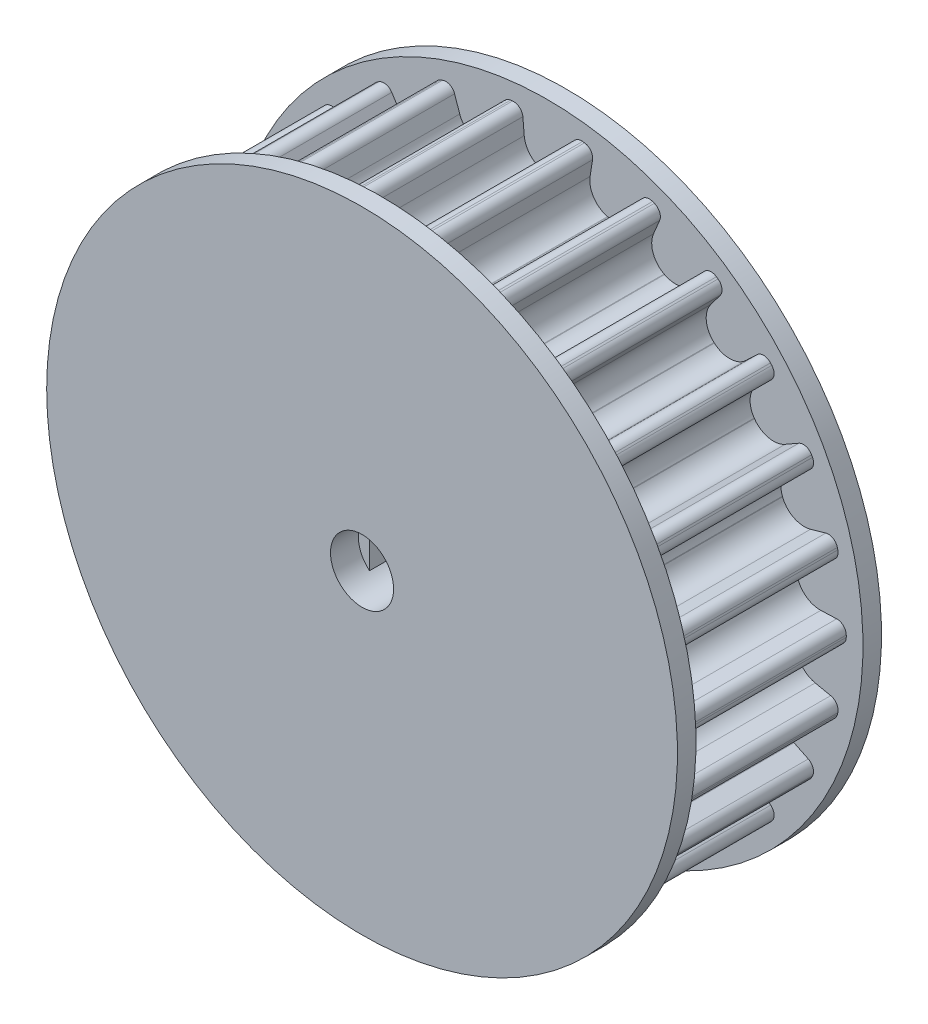
from build123d import *

# Parameters (mm, degrees)
SKETCH1_R                = 32.2
BOSS_EXTRUDE1_DEPTH      = 9
CUT_EXTRUDE2_REACH       = 50.966
FILLET1_R                = 2.5
FILLET2_R                = 1
CIRPATTERN1_COUNT        = 26
FILLET1_OF_CIRPATTERN1_R = 2.5
FILLET2_OF_CIRPATTERN1_R = 1
SKETCH3_R                = 34
BOSS_EXTRUDE2_DEPTH      = 2
CUT_EXTRUDE3_DEPTH       = 53.877216266
SKETCH5_W                = 3
SKETCH5_H                = 5
CUT_EXTRUDE4_DEPTH       = 18.5
SKETCH6_R                = 3
CUT_EXTRUDE5_DEPTH       = 18
SKETCH8_R                = 1.55
CUT_EXTRUDE6_DEPTH       = 35
CUT_EXTRUDE7_START       = -3
CUT_EXTRUDE7_DEPTH       = 3


with BuildPart() as part:
    # Sketch1 → Boss-Extrude1 (new, symmetric)
    with BuildSketch(Plane.XY):
        Circle(SKETCH1_R)
    extrude(amount=BOSS_EXTRUDE1_DEPTH, both=True)

    # Sketch2 → Cut-Extrude2 (cut, up to next)
    with BuildSketch(Plane.XY.offset(9), mode=Mode.PRIVATE) as cut_extrude2_sk1:
        with BuildLine():
            Line((-2.75, 32.082354963), (-2.321415502, 27.082354963))
            Line((-2.321415502, 27.082354963), (2.321415502, 27.082354963))
            Line((2.321415502, 27.082354963), (2.75, 32.082354963))
            ThreePointArc((2.75, 32.082354963), (0, 35.078160605), (-2.75, 32.082354963))
        make_face()
    cut_extrude2_tool1 = extrude(cut_extrude2_sk1.sketch, amount=-CUT_EXTRUDE2_REACH, mode=Mode.PRIVATE) & part.part
    cut_extrude2 = cut_extrude2_tool1.solids().sort_by_distance((0, 30.927212, 9))[0]
    add(cut_extrude2, mode=Mode.SUBTRACT)

    # Fillet1
    fillet1_edges = [part.edges().sort_by_distance(p)[0] for p in [
        (2.321415502, 27.082354963, 0),
        (-2.321415502, 27.082354963, 0),
    ]]
    fillet(fillet1_edges, radius=FILLET1_R)

    # Fillet2
    fillet2_edges = [part.edges().sort_by_distance(p)[0] for p in [
        (2.75, 32.082354963, 0),
        (-2.75, 32.082354963, 0),
    ]]
    fillet(fillet2_edges, radius=FILLET2_R)

    # CirPattern1: Cut-Extrude2 ×26 about axis
    cirpattern1_axis = Axis((0, 0, -7.712921614), (0, 0, 1))
    for i in range(1, CIRPATTERN1_COUNT):
        add(cut_extrude2.rotate(cirpattern1_axis, i * 360 / CIRPATTERN1_COUNT), mode=Mode.SUBTRACT)

    # Fillet1 of CirPattern1
    fillet1_of_cirpattern1_edges = [part.edges().sort_by_distance(p)[0] for p in [
        (-4.227272382, 26.850942041, 0),
        (-8.735191155, 25.739839855, 0),
        (-10.530286561, 25.059049967, 0),
        (-14.641309249, 22.901418816, 0),
        (-16.221318761, 21.810816994, 0),
        (-19.696527669, 18.732050557, 0),
        (-20.969626876, 17.295018617, 0),
        (-23.607055494, 13.474043609, 0),
        (-24.499256499, 11.774096623, 0),
        (-26.145627063, 7.432974222, 0),
        (-26.605078386, 5.56890693, 0),
        (-27.164709822, 0.959927392, 0),
        (-27.164709822, -0.959927392, 0),
        (-26.605078386, -5.56890693, 0),
        (-26.145627063, -7.432974222, 0),
        (-24.499256499, -11.774096623, 0),
        (-23.607055494, -13.474043609, 0),
        (-20.969626876, -17.295018617, 0),
        (-19.696527669, -18.732050557, 0),
        (-16.221318761, -21.810816994, 0),
        (-14.641309249, -22.901418816, 0),
        (-10.530286561, -25.059049967, 0),
        (-8.735191155, -25.739839855, 0),
        (-4.227272382, -26.850942041, 0),
        (-2.321415502, -27.082354963, 0),
        (2.321415502, -27.082354963, 0),
        (4.227272382, -26.850942041, 0),
        (8.735191155, -25.739839855, 0),
        (10.530286561, -25.059049967, 0),
        (14.641309249, -22.901418816, 0),
        (16.221318761, -21.810816994, 0),
        (19.696527669, -18.732050557, 0),
        (20.969626876, -17.295018617, 0),
        (23.607055494, -13.474043609, 0),
        (24.499256499, -11.774096623, 0),
        (26.145627063, -7.432974222, 0),
        (26.605078386, -5.56890693, 0),
        (27.164709822, -0.959927392, 0),
        (27.164709822, 0.959927392, 0),
        (26.605078386, 5.56890693, 0),
        (26.145627063, 7.432974222, 0),
        (24.499256499, 11.774096623, 0),
        (23.607055494, 13.474043609, 0),
        (20.969626876, 17.295018617, 0),
        (19.696527669, 18.732050557, 0),
        (16.221318761, 21.810816994, 0),
        (14.641309249, 22.901418816, 0),
        (10.530286561, 25.059049967, 0),
        (8.735191155, 25.739839855, 0),
        (4.227272382, 26.850942041, 0),
    ]]
    fillet(fillet1_of_cirpattern1_edges, radius=FILLET1_OF_CIRPATTERN1_R)

    # Fillet2 of CirPattern1
    fillet2_of_cirpattern1_edges = [part.edges().sort_by_distance(p)[0] for p in [
        (-5.007720092, 31.808218112, 0),
        (-10.347900088, 30.491981959, 0),
        (-12.474409695, 29.685503243, 0),
        (-17.344417836, 27.129525796, 0),
        (-19.216131949, 25.837574827, 0),
        (-23.332941063, 22.190400207, 0),
        (-24.841082461, 20.488060478, 0),
        (-27.965438568, 15.961649216, 0),
        (-29.022359555, 13.947854525, 0),
        (-30.972686434, 8.80526519, 0),
        (-31.516962603, 6.597049966, 0),
        (-32.179914345, 1.137151158, 0),
        (-32.179914345, -1.137151158, 0),
        (-31.516962603, -6.597049966, 0),
        (-30.972686434, -8.80526519, 0),
        (-29.022359555, -13.947854525, 0),
        (-27.965438568, -15.961649216, 0),
        (-24.841082461, -20.488060478, 0),
        (-23.332941063, -22.190400207, 0),
        (-19.216131949, -25.837574827, 0),
        (-17.344417836, -27.129525796, 0),
        (-12.474409695, -29.685503243, 0),
        (-10.347900088, -30.491981959, 0),
        (-5.007720092, -31.808218112, 0),
        (-2.75, -32.082354963, 0),
        (2.75, -32.082354963, 0),
        (5.007720092, -31.808218112, 0),
        (10.347900088, -30.491981959, 0),
        (12.474409695, -29.685503243, 0),
        (17.344417836, -27.129525796, 0),
        (19.216131949, -25.837574827, 0),
        (23.332941063, -22.190400207, 0),
        (24.841082461, -20.488060478, 0),
        (27.965438568, -15.961649216, 0),
        (29.022359555, -13.947854525, 0),
        (30.972686434, -8.80526519, 0),
        (31.516962603, -6.597049966, 0),
        (32.179914345, -1.137151158, 0),
        (32.179914345, 1.137151158, 0),
        (31.516962603, 6.597049966, 0),
        (30.972686434, 8.80526519, 0),
        (29.022359555, 13.947854525, 0),
        (27.965438568, 15.961649216, 0),
        (24.841082461, 20.488060478, 0),
        (23.332941063, 22.190400207, 0),
        (19.216131949, 25.837574827, 0),
        (17.344417836, 27.129525796, 0),
        (12.474409695, 29.685503243, 0),
        (10.347900088, 30.491981959, 0),
        (5.007720092, 31.808218112, 0),
    ]]
    fillet(fillet2_of_cirpattern1_edges, radius=FILLET2_OF_CIRPATTERN1_R)

    # Sketch3 → Boss-Extrude2 (add)
    with BuildSketch(Plane(origin=(0, 0, -9), x_dir=(-1, 0, 0), z_dir=(0, 0, -1))):
        Circle(SKETCH3_R)
    boss_extrude2 = extrude(amount=BOSS_EXTRUDE2_DEPTH)

    # Mirror1: Boss-Extrude2 across plane
    add(boss_extrude2.mirror(Plane.XY))

    # Sketch4 → Cut-Extrude3 (cut, through all)
    with BuildSketch(Plane(origin=(0, 0, -11), x_dir=(-1, 0, 0), z_dir=(0, 0, -1))):
        with BuildLine():
            Line((2.2, -2.592296279), (2.2, 2.592296279))
            ThreePointArc((2.2, 2.592296279), (-3.4, 0), (2.2, -2.592296279))
        make_face()
    extrude(amount=-CUT_EXTRUDE3_DEPTH, mode=Mode.SUBTRACT)

    # Sketch5 → Cut-Extrude4 (cut)
    with BuildSketch(Plane(origin=(0, 0, -11), x_dir=(-1, 0, 0), z_dir=(0, 0, -1))):
        with Locations((7.08920513, 0)):
            Rectangle(SKETCH5_W, SKETCH5_H)
    extrude(amount=-CUT_EXTRUDE4_DEPTH, mode=Mode.SUBTRACT)

    # Sketch6 → Cut-Extrude5 (cut)
    with BuildSketch(Plane.ZY.offset(35.58920513)):
        with Locations((2.5, 0)):
            Circle(SKETCH6_R)
    extrude(amount=-CUT_EXTRUDE5_DEPTH, mode=Mode.SUBTRACT)

    # Sketch8 → Cut-Extrude6 (cut)
    with BuildSketch(Plane.ZY.offset(35.58920513)):
        with Locations((2.5, 0)):
            Circle(SKETCH8_R)
    extrude(amount=-CUT_EXTRUDE6_DEPTH, mode=Mode.SUBTRACT)

    # Sketch9 → Cut-Extrude7 (cut)
    with BuildSketch(Plane.XY.offset(11).offset(CUT_EXTRUDE7_START)):
        with BuildLine():
            Line((-2.2, -2.592296279), (-2.2, 2.592296279))
            ThreePointArc((-2.2, 2.592296279), (-3.4, 0), (-2.2, -2.592296279))
        make_face()
    extrude(amount=CUT_EXTRUDE7_DEPTH, mode=Mode.SUBTRACT)


solid = part.part
